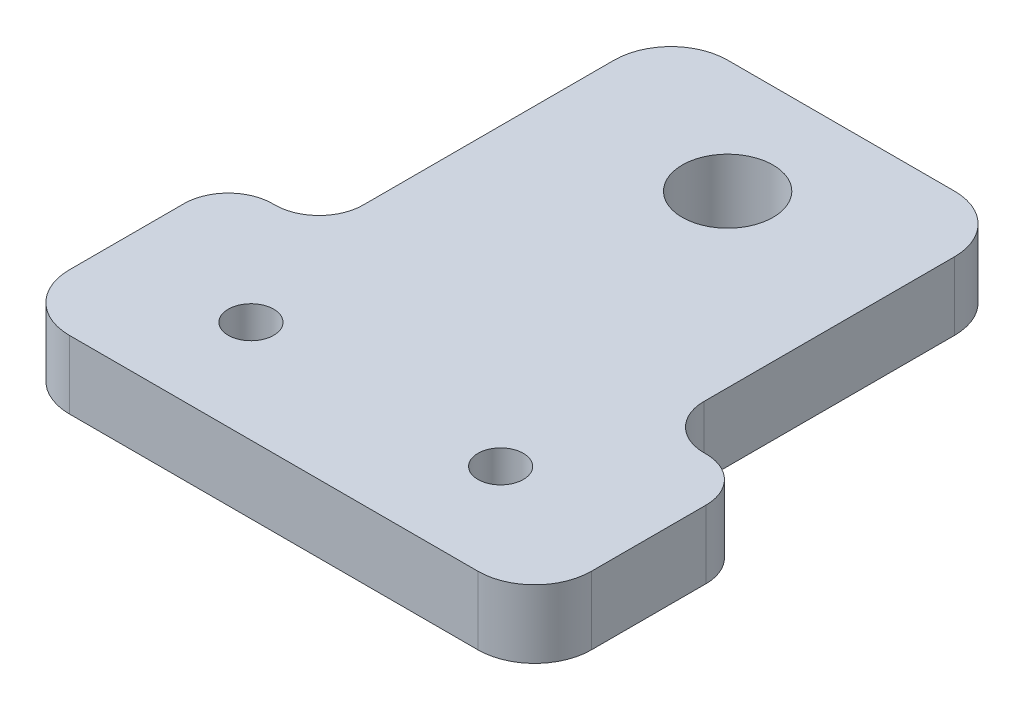
from build123d import *

# Parameters (mm, degrees)
SKETCH1_R           = 4
SKETCH1_R_2         = 2
BOSS_EXTRUDE1_DEPTH = 6
FILLET2_R           = 5
FILLET3_R           = 3.9


with BuildPart() as part:
    # Sketch1 → Boss-Extrude1 (new body)
    with BuildSketch(Plane(origin=(0, 0, 0), x_dir=(1, 0, 0), z_dir=(0, 1, 0))):
        Polygon((-23, 0), (23, 0), (23, 19), (15, 19), (15, 50), (-15, 50), (-15, 19), (-23, 19), align=None)
        with Locations(Location((0, 40, 0), (0, 0, 270))):
            Circle(SKETCH1_R, mode=Mode.SUBTRACT)
        with Locations(Location((11, 9, 0), (0, 0, 270))):
            Circle(SKETCH1_R_2, mode=Mode.SUBTRACT)
        with Locations(Location((-11, 9, 0), (0, 0, 90))):
            Circle(SKETCH1_R_2, mode=Mode.SUBTRACT)
    extrude(amount=BOSS_EXTRUDE1_DEPTH)

    # Fillet2
    fillet2_edges = [part.edges().sort_by_distance(p)[0] for p in [
        (15, 3, -50),
        (23, 3, 0),
        (-23, 3, 0),
        (-15, 3, -50),
    ]]
    fillet(fillet2_edges, radius=FILLET2_R)

    # Fillet3
    fillet3_edges = [part.edges().sort_by_distance(p)[0] for p in [
        (15, 3, -19),
        (23, 3, -19),
        (-23, 3, -19),
        (-15, 3, -19),
    ]]
    fillet(fillet3_edges, radius=FILLET3_R)


solid = part.part
